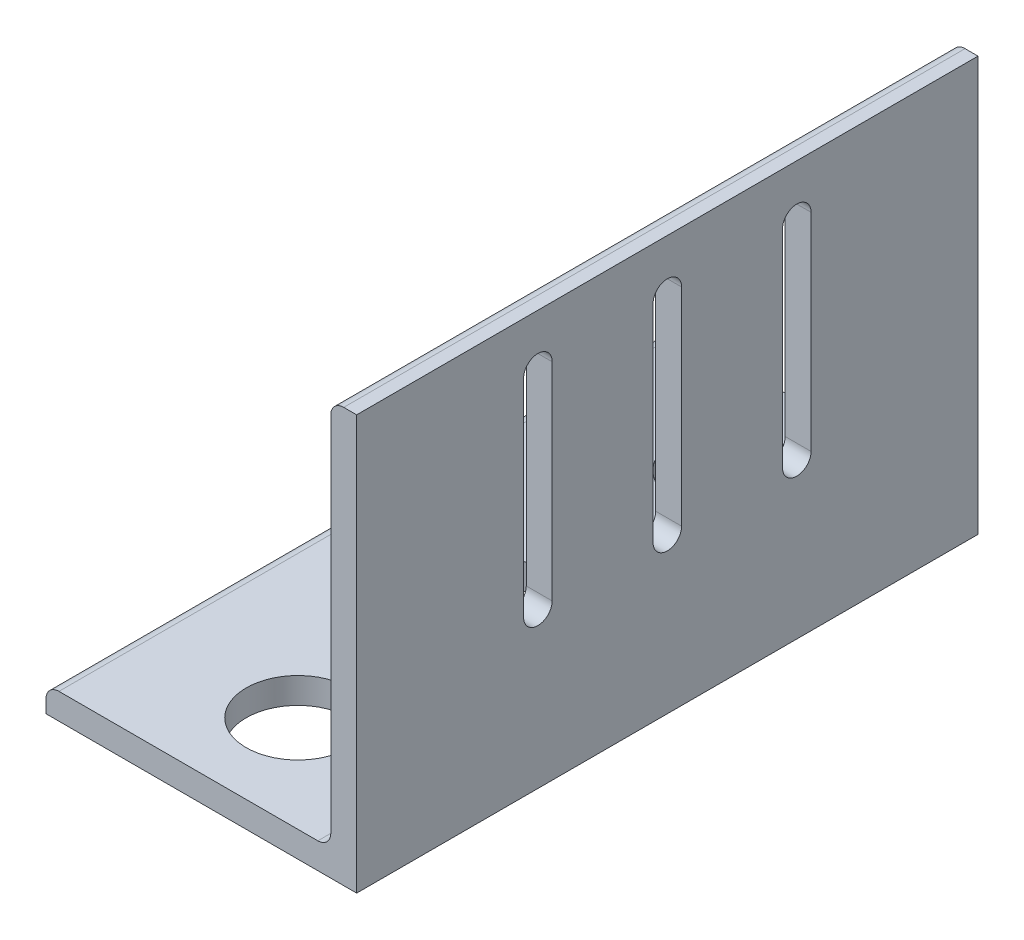
from build123d import *

# Parameters (mm, degrees)
BOSS_EXTRUDE1_DEPTH = 76.2
CUT_EXTRUDE1_DEPTH  = 10
SKETCH4_R           = 10
SKETCH4_R_2         = 12.7
CUT_EXTRUDE2_DEPTH  = 10


with BuildPart() as part:
    # Sketch2 → Boss-Extrude1 (new, symmetric)
    with BuildSketch(Plane.XY):
        with BuildLine():
            Line((-38.1, 0), (38.1, 0))
            Line((38.1, 0), (38.1, 101.6))
            Line((38.1, 101.6), (34.925, 101.6))
            ThreePointArc((34.925, 101.6), (32.67993597, 100.67006403), (31.75, 98.425))
            Line((31.75, 98.425), (31.75, 9.525))
            ThreePointArc((31.75, 9.525), (30.82006403, 7.27993597), (28.575, 6.35))
            Line((28.575, 6.35), (-34.925, 6.35))
            ThreePointArc((-34.925, 6.35), (-37.17006403, 5.42006403), (-38.1, 3.175))
            Line((-38.1, 3.175), (-38.1, 0))
        make_face()
    extrude(amount=BOSS_EXTRUDE1_DEPTH, both=True)

    # Sketch3 → Cut-Extrude1 (cut)
    with BuildSketch(Plane(origin=(38.1, 0, 0), x_dir=(0, 0, -1), z_dir=(1, 0, 0))):
        with BuildLine():
            Line((-28.25, 88.9), (-28.25, 38.1))
            ThreePointArc((-28.25, 38.1), (-31.75, 34.6), (-35.25, 38.1))
            Line((-35.25, 38.1), (-35.25, 88.9))
            ThreePointArc((-35.25, 88.9), (-31.75, 92.4), (-28.25, 88.9))
        make_face()
        with BuildLine():
            Line((28.25, 88.9), (28.25, 38.1))
            ThreePointArc((28.25, 38.1), (31.75, 34.6), (35.25, 38.1))
            Line((35.25, 38.1), (35.25, 88.9))
            ThreePointArc((35.25, 88.9), (31.75, 92.4), (28.25, 88.9))
        make_face()
        with BuildLine():
            Line((3.5, 88.9), (3.5, 38.1))
            ThreePointArc((3.5, 38.1), (0, 34.6), (-3.5, 38.1))
            Line((-3.5, 38.1), (-3.5, 88.9))
            ThreePointArc((-3.5, 88.9), (0, 92.4), (3.5, 88.9))
        make_face()
    extrude(amount=-CUT_EXTRUDE1_DEPTH, mode=Mode.SUBTRACT)

    # Sketch4 → Cut-Extrude2 (cut)
    with BuildSketch(Plane.XZ):
        with Locations(Location((0, 0, 0), (0, 0, 270))):
            Circle(SKETCH4_R)
        with Locations(Location((0, 52.5, 0), (0, 0, 270))):
            Circle(SKETCH4_R_2)
        with Locations(Location((0, -52.5, 0), (0, 0, 270))):
            Circle(SKETCH4_R_2)
    extrude(amount=-CUT_EXTRUDE2_DEPTH, mode=Mode.SUBTRACT)


solid = part.part
